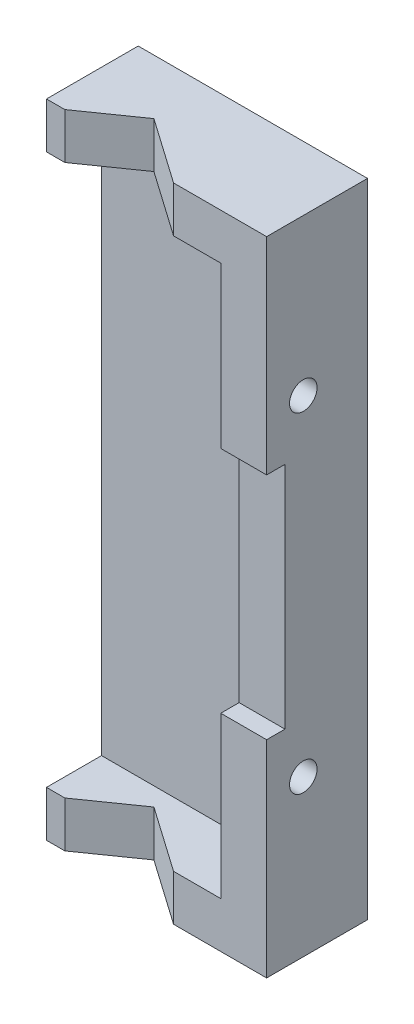
from build123d import *

# Parameters (mm, degrees)
SKETCH1_W           = 25
SKETCH1_H           = 70
BOSS_EXTRUDE1_DEPTH = 4
BOSS_EXTRUDE2_DEPTH = 5
BOSS_EXTRUDE3_DEPTH = 5
SKETCH5_W           = 7
SKETCH5_H           = 60
SKETCH5_R           = 1.5
BOSS_EXTRUDE4_DEPTH = 5
CUT_EXTRUDE1_REACH  = 43.785
SKETCH6_W           = 2
SKETCH6_H           = 25


with BuildPart() as part:
    # Sketch1 → Boss-Extrude1 (new body)
    with BuildSketch(Plane.XY):
        Rectangle(SKETCH1_W, SKETCH1_H)
    extrude(amount=BOSS_EXTRUDE1_DEPTH)

    # Sketch2 → Boss-Extrude2 (add)
    with BuildSketch(Plane(origin=(0, 35, 0), x_dir=(1, 0, 0), z_dir=(0, 1, 0))):
        Polygon((-4.787407973, -6), (-10.5, -10), (-12.5, -10), (-12.5, -4), (12.5, -4), (12.5, -11), (2.353332061, -11), align=None)
    extrude(amount=-BOSS_EXTRUDE2_DEPTH)

    # Sketch3 → Boss-Extrude3 (add)
    with BuildSketch(Plane.XZ.offset(35)):
        Polygon((2.353332061, 11), (-4.787407973, 6), (-10.5, 10), (-12.5, 10), (-12.5, 4), (12.5, 4), (12.5, 11), align=None)
    extrude(amount=-BOSS_EXTRUDE3_DEPTH)

    # Sketch5 → Boss-Extrude4 (add)
    with BuildSketch(Plane(origin=(12.5, 0, 0), x_dir=(0, 0, -1), z_dir=(1, 0, 0))):
        with Locations((-7.5, 0)):
            Rectangle(SKETCH5_W, SKETCH5_H)
        with Locations((-7, 18)):
            Circle(SKETCH5_R, mode=Mode.SUBTRACT)
        with Locations((-7, -18)):
            Circle(SKETCH5_R, mode=Mode.SUBTRACT)
    extrude(amount=-BOSS_EXTRUDE4_DEPTH)

    # Sketch6 → Cut-Extrude1 (cut, up to next)
    with BuildSketch(Plane.ZY.offset(-7.5), mode=Mode.PRIVATE) as cut_extrude1_sk1:
        with Locations((10, 0)):
            Rectangle(SKETCH6_W, SKETCH6_H)
    cut_extrude1_tool1 = extrude(cut_extrude1_sk1.sketch, amount=-CUT_EXTRUDE1_REACH, mode=Mode.PRIVATE) & part.part
    add(cut_extrude1_tool1.solids().sort_by_distance((7.5, 0, 10))[0], mode=Mode.SUBTRACT)


solid = part.part
